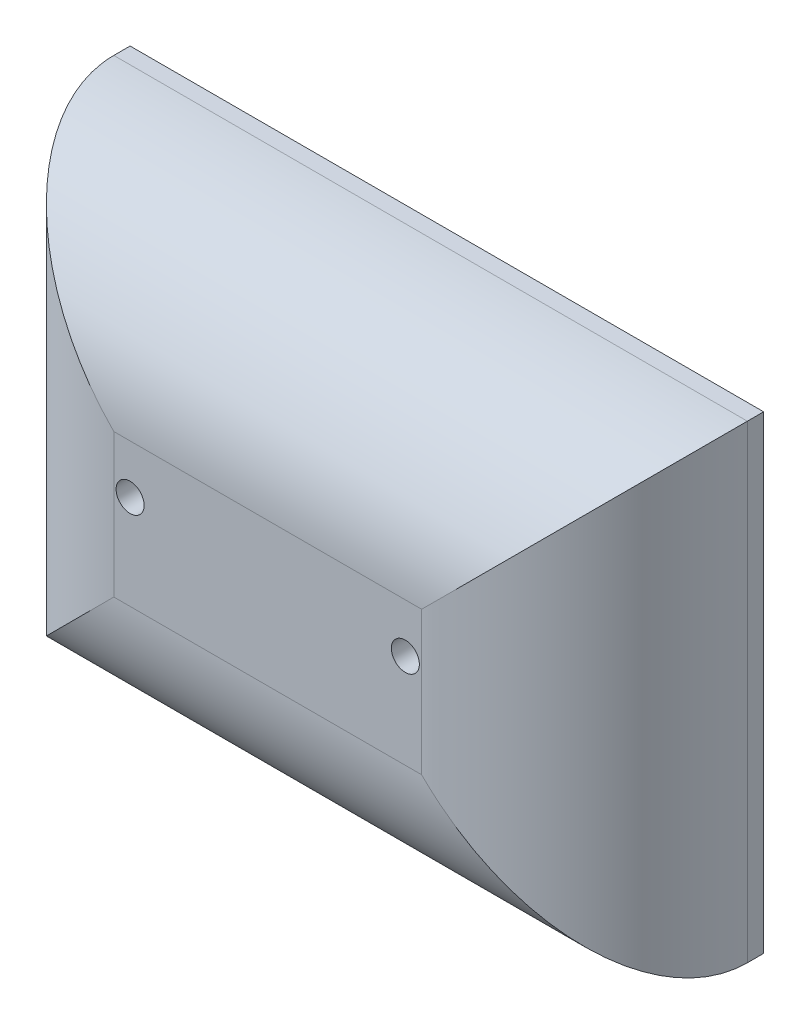
from build123d import *

# Parameters (mm, degrees)
AUFSATZ_LINEAR_AUSTRAGEN1_DEPTH                     = 55
SCHNITT_LINEAR_AUSTRAGEN1_DEPTH                     = 183.25960194184557
SCHNITT_LINEAR_AUSTRAGEN2_DEPTH                     = 215.5675884191273
STIRNSENKUNG_F_R_M4_SENKSCHRAUBE_KOPF_B_D           = 4.5
STIRNSENKUNG_F_R_M4_SENKSCHRAUBE_KOPF_B_CBORE_D     = 8.6
STIRNSENKUNG_F_R_M4_SENKSCHRAUBE_KOPF_B_CBORE_DEPTH = 50


with BuildPart() as part:
    # Skizze2 → Aufsatz-Linear austragen1 (new body)
    with BuildSketch(Plane.XY):
        Polygon((97.25, -71.99999999999999), (-97.25, -72.00000000000001), (-97.25, 72), (97.25, 72.00000000000001), align=None)
    extrude(amount=AUFSATZ_LINEAR_AUSTRAGEN1_DEPTH)

    # Skizze3 → Schnitt-Linear austragen1 (cut, through all)
    with BuildSketch(Plane.XZ.offset(72)):
        with BuildLine():
            Line((-47.250000000000014, 54.99999999999999), (-31.187648825052438, 55))
            Line((-31.187648825052438, 55), (-49.06524576519668, 93.49392426446363))
            Line((-49.06524576519668, 93.49392426446363), (-152.6979191152644, 34.404714288264984))
            Line((-152.6979191152644, 34.404714288264984), (-97.25000000000001, -29.09207494836323))
            Line((-97.25000000000001, -29.09207494836323), (-97.25, 4.99999999999999))
            ThreePointArc((-97.25, 4.99999999999999), (-82.60533905932738, 40.35533905932737), (-47.250000000000014, 54.99999999999999))
        make_face()
    schnitt_linear_austragen1 = extrude(amount=-SCHNITT_LINEAR_AUSTRAGEN1_DEPTH, mode=Mode.SUBTRACT)

    # Spiegeln3: Schnitt-Linear austragen1 across plane
    add(schnitt_linear_austragen1.mirror(Plane(origin=(0, 0, 0), x_dir=(0, 0, 1), z_dir=(1, 0, 0))), mode=Mode.SUBTRACT)

    # Skizze6 → Schnitt-Linear austragen2 (cut, through all)
    with BuildSketch(Plane(origin=(97.25, 0, 0), x_dir=(0, 0, -1), z_dir=(1, 0, 0))):
        with BuildLine():
            Line((-4.999999999999997, 72.00000000000001), (11.062351174947562, 72.00000000000003))
            Line((11.062351174947562, 72.00000000000003), (-41.4687477452512, 93.52582627901205))
            Line((-41.4687477452512, 93.52582627901205), (-130.24502976788665, 42.907423802585875))
            Line((-130.24502976788665, 42.907423802585875), (-54.99999999999999, -43.260242586178926))
            Line((-54.99999999999999, -43.260242586178926), (-55, 22))
            ThreePointArc((-55, 22), (-40.35533905932737, 57.35533905932739), (-4.999999999999997, 72.00000000000001))
        make_face()
    schnitt_linear_austragen2 = extrude(amount=-SCHNITT_LINEAR_AUSTRAGEN2_DEPTH, mode=Mode.SUBTRACT)

    # Spiegeln4: Schnitt-Linear austragen2 across plane
    add(schnitt_linear_austragen2.mirror(Plane.ZX), mode=Mode.SUBTRACT)

    # Stirnsenkung für M4 Senkschraube (Kopf Button)1 (through all)
    with Locations(Plane.XY.offset(55)):
        with Locations((-42.25, 7)):
            stirnsenkung_f_r_m4_senkschraube_kopf_b = CounterBoreHole(STIRNSENKUNG_F_R_M4_SENKSCHRAUBE_KOPF_B_D / 2, STIRNSENKUNG_F_R_M4_SENKSCHRAUBE_KOPF_B_CBORE_D / 2, STIRNSENKUNG_F_R_M4_SENKSCHRAUBE_KOPF_B_CBORE_DEPTH)

    # Spiegeln5: Stirnsenkung für M4 Senkschraube (Kopf Button)1 across plane
    add(stirnsenkung_f_r_m4_senkschraube_kopf_b.mirror(Plane(origin=(0, 0, 0), x_dir=(0, 0, 1), z_dir=(1, 0, 0))), mode=Mode.SUBTRACT)


solid = part.part
